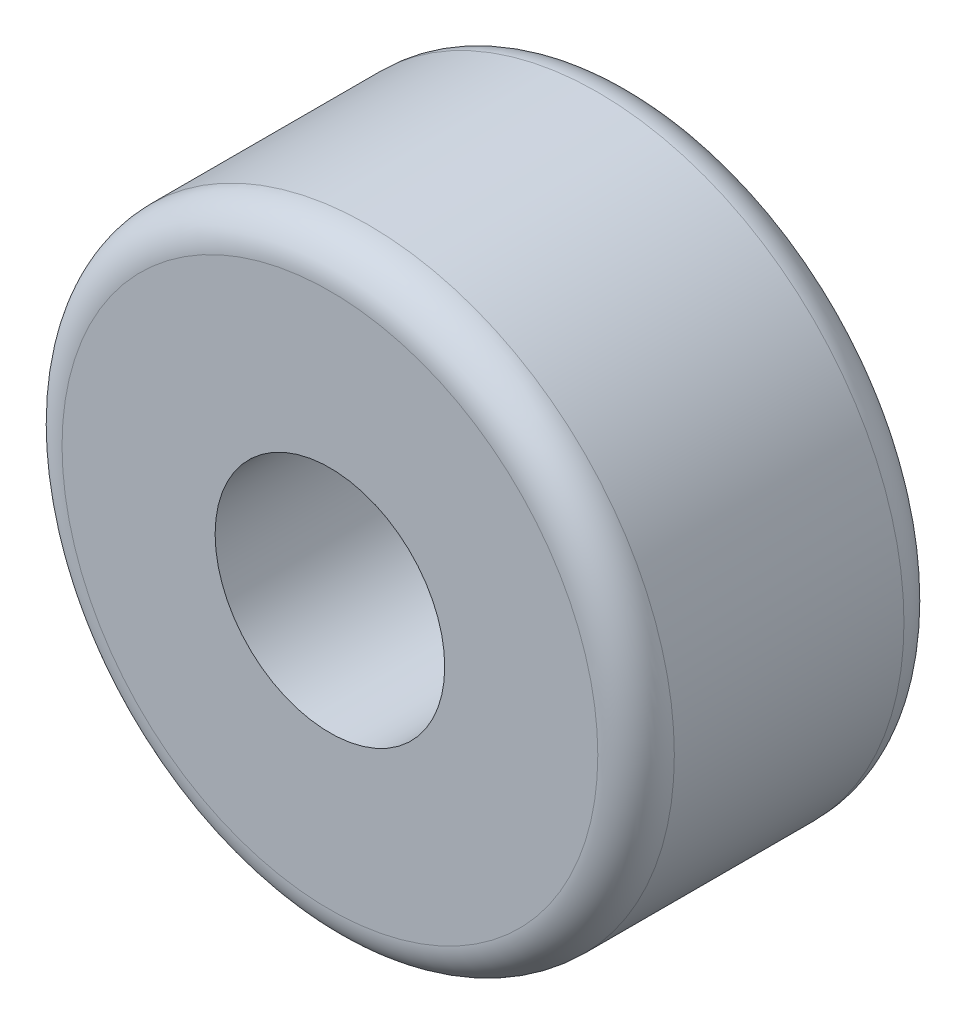
from build123d import *

# Parameters (mm, degrees)
SKETCH1_R           = 8
SKETCH1_R_2         = 3
BOSS_EXTRUDE1_DEPTH = 8
FILLET1_R           = 1


with BuildPart() as part:
    # Sketch1 → Boss-Extrude1 (new body)
    with BuildSketch(Plane.XY):
        with Locations((0.028728991, 0.033652542)):
            Circle(SKETCH1_R)
        with Locations((0.028728991, 0.033652542)):
            Circle(SKETCH1_R_2, mode=Mode.SUBTRACT)
    extrude(amount=BOSS_EXTRUDE1_DEPTH)

    # Fillet1
    fillet1_edges = [part.edges().sort_by_distance(p)[0] for p in [
        (-7.971271009, 0.033652542, 0),
        (-7.971271009, 0.033652542, 8),
    ]]
    fillet(fillet1_edges, radius=FILLET1_R)


solid = part.part
